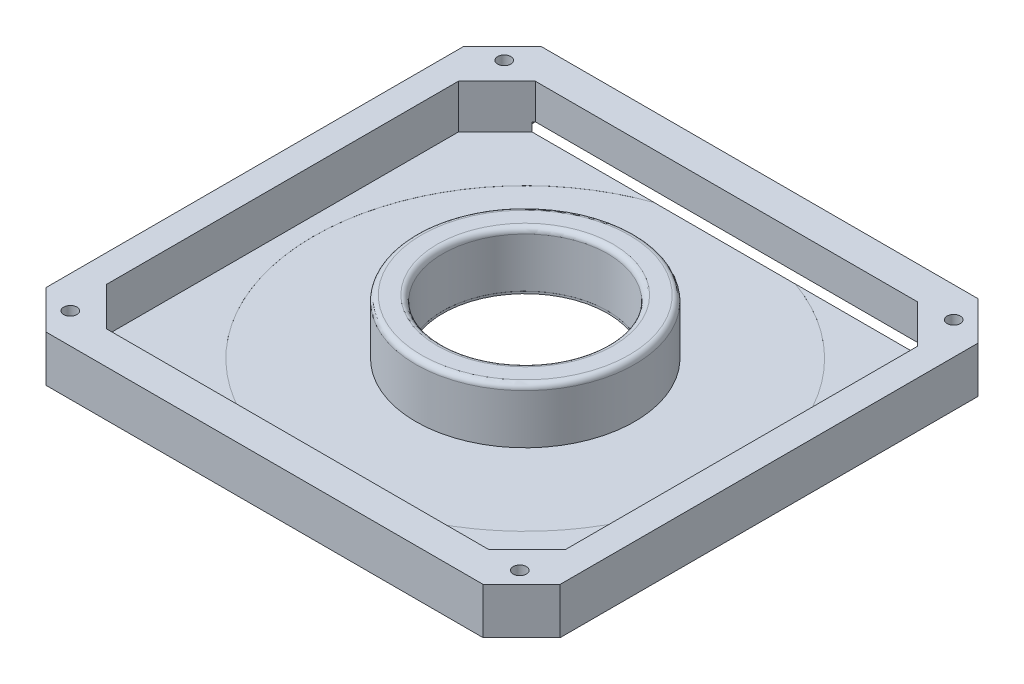
from build123d import *

# Parameters (mm, degrees)
BOSS_EXTRUDE1_DEPTH           = 8.4
CUT_EXTRUDE1_DEPTH            = 66.430287329
CUT_EXTRUDE1_DEPTH_BACK       = 2
CUT_EXTRUDE2_DEPTH            = 8
SKETCH8_R                     = 19.9
BOSS_EXTRUDE2_DEPTH           = 10
FILLET1_R                     = 1
SKETCH9_R                     = 38.5
CUT_EXTRUDE4_DEPTH            = 0.01
M2_CLEARANCE_HOLE1_AT_2_COUNT = 2
M2_CLEARANCE_HOLE1_AT_2_PITCH = 81.742360825
M2_CLEARANCE_HOLE1_AT_3_COUNT = 2
M2_CLEARANCE_HOLE1_AT_3_PITCH = 113.62
M2_CLEARANCE_HOLE1_AT_4_COUNT = 2
M2_CLEARANCE_HOLE1_AT_4_PITCH = 78.915719896
SKETCH13_R                    = 15
CUT_EXTRUDE5_DEPTH            = 66.71698791
FILLET2_R                     = 1


with BuildPart() as part:
    # Sketch4 → Boss-Extrude1 (new body)
    with BuildSketch(Plane(origin=(0, 0, 0), x_dir=(1, 0, 0), z_dir=(0, 1, 0))):
        Polygon((-46.75, 38), (-39.75, 45), (39.75, 45), (46.75, 38), (46.75, -38), (39.75, -45), (-39.75, -45), (-46.75, -38), align=None)
    extrude(amount=BOSS_EXTRUDE1_DEPTH)

    # Sketch5 → Cut-Extrude1 (cut, two sides: drawn at the far end of the back side and taken through both)
    with BuildSketch(Plane.XZ.offset(-CUT_EXTRUDE1_DEPTH_BACK)):
        with BuildLine():
            Line((36.75, -300.538184403), (36.75, -45))
            Line((36.75, -45), (36.75, -39.704788024))
            ThreePointArc((36.75, -39.704788024), (36.457106781, -38.997681243), (35.75, -38.704788024))
            Line((35.75, -38.704788024), (-35.75, -38.704788024))
            ThreePointArc((-35.75, -38.704788024), (-36.457106781, -38.997681243), (-36.75, -39.704788024))
            Line((-36.75, -39.704788024), (-36.75, -45))
            Line((-36.75, -45), (-36.75, -300.538184403))
            Line((-36.75, -300.538184403), (-36.75, -811.614553209))
            Line((-36.75, -811.614553209), (36.75, -811.614553209))
            Line((36.75, -811.614553209), (36.75, -300.538184403))
        make_face()
    extrude(amount=CUT_EXTRUDE1_DEPTH + CUT_EXTRUDE1_DEPTH_BACK, mode=Mode.SUBTRACT)

    # Sketch6 → Cut-Extrude2 (cut)
    with BuildSketch(Plane(origin=(0, 8.4, 0), x_dir=(1, 0, 0), z_dir=(0, 1, 0))):
        Polygon((-41.75, 32), (-34.75, 39), (34.75, 39), (41.75, 32), (41.75, -32), (34.75, -39), (-34.75, -39), (-41.75, -32), align=None)
    extrude(amount=-CUT_EXTRUDE2_DEPTH, mode=Mode.SUBTRACT)

    # Sketch8 → Boss-Extrude2 (add)
    with BuildSketch(Plane(origin=(0, 0.4, 0), x_dir=(1, 0, 0), z_dir=(0, 1, 0))):
        with Locations(Location((0, 2.404788, 0), (0, 0, 90))):
            Circle(SKETCH8_R)
    extrude(amount=BOSS_EXTRUDE2_DEPTH)

    # Fillet1
    fillet1_edges = [part.edges().sort_by_distance(p)[0] for p in [
        (0, 10.4, 17.495212),
    ]]
    fillet(fillet1_edges, radius=FILLET1_R)

    # Sketch9 → Cut-Extrude4 (cut)
    with BuildSketch(Plane(origin=(0, 0.4, 0), x_dir=(1, 0, 0), z_dir=(0, 1, 0))):
        with Locations((0, 2.404788)):
            Circle(SKETCH9_R)
    extrude(amount=-CUT_EXTRUDE4_DEPTH, mode=Mode.SUBTRACT)


with BuildPart() as cut_extrude4_piece_1:
    # of the separate pieces the step leaves, piece 1, a body of its own (cut_extrude4_pieces)
    add(part.part.solids().sort_by_distance((-34.75, 0.4, 39))[0])

    # Sketch10 → M2 Clearance Hole1 (revolve, cut)
    with BuildSketch(Plane(origin=(40.871180413, 8.4, 39.457859948), x_dir=(0, 0, 1), z_dir=(1, 0, 0))):
        Polygon((0, 0), (0, 38.821032743), (1.2, 38.1), (1.2, 0), align=None)
    m2_clearance_hole1 = revolve(axis=Axis((40.871180413, 14.75, 39.457859948), (0, -1, 0)), mode=Mode.SUBTRACT)

    # M2 Clearance Hole1 at 2: M2 Clearance Hole1 ×2
    with Locations(*[(-i * M2_CLEARANCE_HOLE1_AT_2_PITCH, 0, 0) for i in range(1, M2_CLEARANCE_HOLE1_AT_2_COUNT)]):
        add(m2_clearance_hole1, mode=Mode.SUBTRACT)

    # M2 Clearance Hole1 at 3: M2 Clearance Hole1 ×2
    with Locations(*[Vector(-0.7194363741011156, 0, -0.6945583514869285) * (i * M2_CLEARANCE_HOLE1_AT_3_PITCH) for i in range(1, M2_CLEARANCE_HOLE1_AT_3_COUNT)]):
        add(m2_clearance_hole1, mode=Mode.SUBTRACT)

    # M2 Clearance Hole1 at 4: M2 Clearance Hole1 ×2
    with Locations(*[(0, 0, -i * M2_CLEARANCE_HOLE1_AT_4_PITCH) for i in range(1, M2_CLEARANCE_HOLE1_AT_4_COUNT)]):
        add(m2_clearance_hole1, mode=Mode.SUBTRACT)


with BuildPart() as cut_extrude4_piece_2:
    # of the separate pieces the step leaves, piece 2, a body of its own (cut_extrude4_pieces)
    add(part.part.solids().sort_by_distance((0, 9.4, -22.304788))[0])


with BuildPart() as cut_extrude5_tool:
    # Sketch13 → Cut-Extrude5 (new, through all)
    with BuildSketch(Plane(origin=(0, 10.4, 0), x_dir=(1, 0, 0), z_dir=(0, 1, 0))):
        with Locations(Location((0, 2.404788, 0), (0, 0, 270))):
            Circle(SKETCH13_R)
    extrude(amount=-CUT_EXTRUDE5_DEPTH)


with BuildPart() as cut_extrude4_piece_1_1:
    add(cut_extrude4_piece_1.part)

    # Cut-Extrude5: cut by cut_extrude5_tool
    add(cut_extrude5_tool.part, mode=Mode.SUBTRACT)


with BuildPart() as cut_extrude4_piece_2_1:
    add(cut_extrude4_piece_2.part)

    # Cut-Extrude5: cut by cut_extrude5_tool
    add(cut_extrude5_tool.part, mode=Mode.SUBTRACT)

    # Fillet2
    fillet2_edges = [cut_extrude4_piece_2_1.edges().sort_by_distance(p)[0] for p in [
        (0, 10.4, -17.404788),
    ]]
    fillet(fillet2_edges, radius=FILLET2_R)


solid = Compound([cut_extrude4_piece_1_1.part, cut_extrude4_piece_2_1.part])
